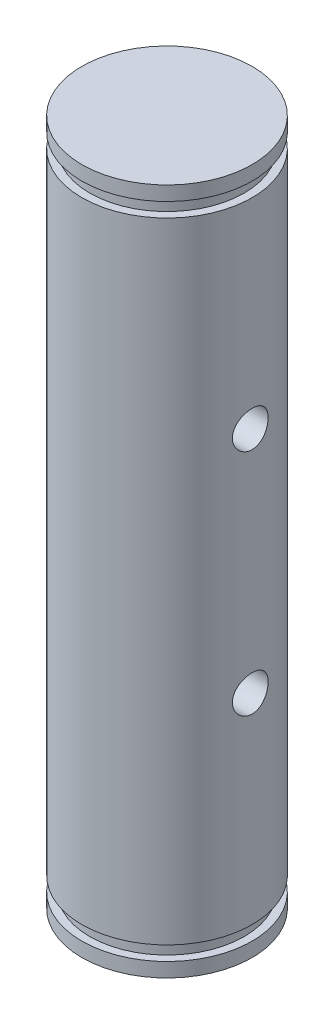
from build123d import *

# Parameters (mm, degrees)
SKETCH_1_R         = 5.95
EXTRUDE_1_DEPTH    = 22
SKETCH_2_R         = 5.4
EXTRUDE_2_DEPTH    = 1
SKETCH_3_R         = 5.95
EXTRUDE_3_DEPTH    = 1
HOLE_WIZARD_M3_2_D = 2.5


with BuildPart() as part:
    # 草图1 → 凸台-拉伸1 (new body)
    with BuildSketch(Plane(origin=(0, 0, 0), x_dir=(1, 0, 0), z_dir=(0, 1, 0))):
        with Locations(Location((5.9, 0, 0), (0, 0, 270))):
            Circle(SKETCH_1_R)
    extrude_1 = extrude(amount=EXTRUDE_1_DEPTH)

    # 草图2 → 凸台-拉伸2 (add)
    with BuildSketch(Plane(origin=(0, 22, 0), x_dir=(1, 0, 0), z_dir=(0, 1, 0))):
        with Locations(Location((5.9, 0, 0), (0, 0, 270))):
            Circle(SKETCH_2_R)
    extrude_2 = extrude(amount=EXTRUDE_2_DEPTH)

    # 草图3 → 凸台-拉伸3 (add)
    with BuildSketch(Plane(origin=(0, 23, 0), x_dir=(1, 0, 0), z_dir=(0, 1, 0))):
        with Locations(Location((5.9, 0, 0), (0, 0, 270))):
            Circle(SKETCH_3_R)
    extrude_3 = extrude(amount=EXTRUDE_3_DEPTH)

    # 镜向10: 凸台-拉伸1, 凸台-拉伸2, 凸台-拉伸3 across plane
    add(extrude_1.mirror(Plane.ZX))
    add(extrude_2.mirror(Plane.ZX))
    add(extrude_3.mirror(Plane.ZX))

    # M3 螺纹孔2 (through all)
    with Locations(Plane(origin=(-0.05, -8, 0), x_dir=(0, 0, -1), z_dir=(-1, 0, 0))):
        with Locations((0, 0), (0, -16)):
            Hole(HOLE_WIZARD_M3_2_D / 2)


solid = part.part
